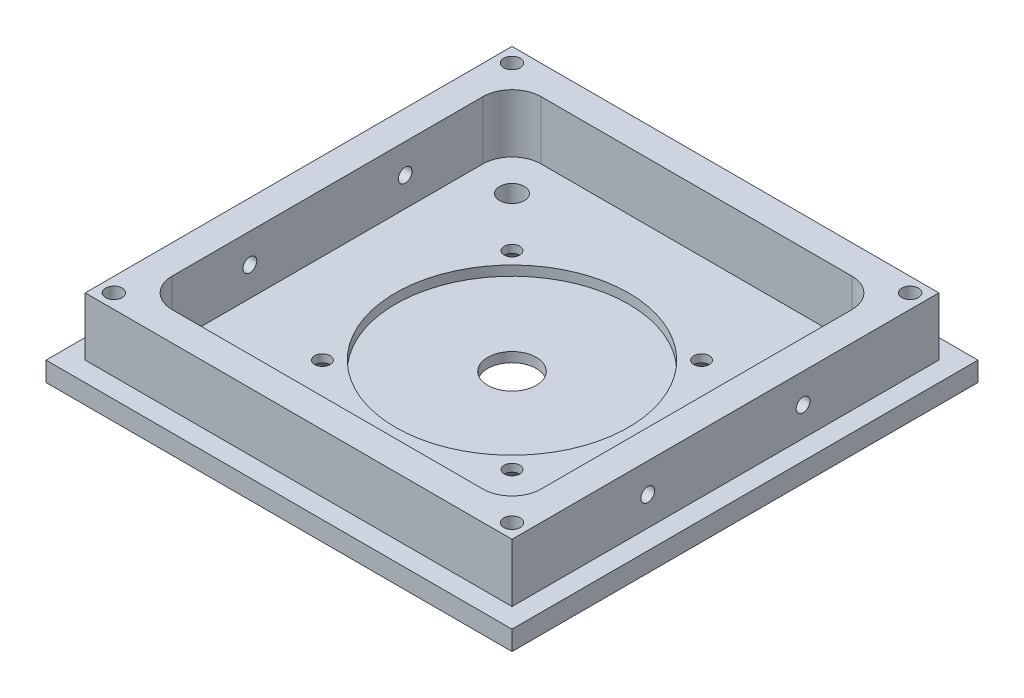
from build123d import *
from OCP.BRepFilletAPI import BRepFilletAPI_MakeChamfer

# Parameters (mm, degrees)
SKETCH1_W                    = 76.2
SKETCH1_H                    = 76.2
BOSS_EXTRUDE1_DEPTH          = 3.175
SKETCH2_W                    = 69.79412
SKETCH2_H                    = 69.79412
SKETCH2_W_2                  = 60.325
SKETCH2_H_2                  = 60.325
BOSS_EXTRUDE2_DEPTH          = 9.525
FILLET1_R                    = 4.7625
SKETCH3_R                    = 19.05
CUT_EXTRUDE1_DEPTH           = 1.5875
SKETCH4_R                    = 3.96875
CUT_EXTRUDE2_DEPTH           = 56.015521957
F_39_0_0995_DIAMETER_HOLE1_D = 2.5273
F_10_32_TAPPED_HOLE1_D       = 4.0386
CHAMFER1_SIZE                = 1.905
CHAMFER1_SIZE2               = 1.655991236
F_6_32_TAPPED_HOLE1_D        = 2.7051
CIRPATTERN1_COUNT            = 4


with BuildPart() as part:
    # Sketch1 → Boss-Extrude1 (new body)
    with BuildSketch(Plane(origin=(0, 0, 0), x_dir=(1, 0, 0), z_dir=(0, 1, 0))):
        Rectangle(SKETCH1_W, SKETCH1_H)
    extrude(amount=BOSS_EXTRUDE1_DEPTH)

    # Sketch2 → Boss-Extrude2 (add)
    with BuildSketch(Plane(origin=(0, 3.175, 0), x_dir=(1, 0, 0), z_dir=(0, 1, 0))):
        Rectangle(SKETCH2_W, SKETCH2_H)
        Rectangle(SKETCH2_W_2, SKETCH2_H_2, mode=Mode.SUBTRACT)
    extrude(amount=BOSS_EXTRUDE2_DEPTH)

    # Fillet1
    fillet1_edges = [part.edges().sort_by_distance(p)[0] for p in [
        (-30.1625, 7.9375, 30.1625),
        (30.1625, 7.9375, 30.1625),
        (30.1625, 7.9375, -30.1625),
        (-30.1625, 7.9375, -30.1625),
    ]]
    fillet(fillet1_edges, radius=FILLET1_R)

    # Sketch3 → Cut-Extrude1 (cut)
    with BuildSketch(Plane(origin=(0, 3.175, 0), x_dir=(1, 0, 0), z_dir=(0, 1, 0))):
        with Locations(Location((0, 0, 0), (0, 0, 270))):
            Circle(SKETCH3_R)
    extrude(amount=-CUT_EXTRUDE1_DEPTH, mode=Mode.SUBTRACT)

    # Sketch4 → Cut-Extrude2 (cut, through all)
    with BuildSketch(Plane(origin=(0, 1.5875, 0), x_dir=(1, 0, 0), z_dir=(0, 1, 0))):
        with Locations(Location((0, 0, 0), (0, 0, 270))):
            Circle(SKETCH4_R)
    extrude(amount=-CUT_EXTRUDE2_DEPTH, mode=Mode.SUBTRACT)

    # #39 (0.0995) Diameter Hole1 (through all)
    with Locations(Plane(origin=(0, 3.175, 0), x_dir=(1, 0, 0), z_dir=(0, 1, 0))):
        with Locations((15.5, 15.5), (-15.5, 15.5), (-15.5, -15.5), (15.5, -15.5), (-23.5966, 23.5966), (23.5966, 23.5966), (23.5966, -23.5966), (-23.5966, -23.5966)):
            Hole(F_39_0_0995_DIAMETER_HOLE1_D / 2)

    # #10-32 Tapped Hole1 (through all)
    with Locations(Plane(origin=(0, 3.175, 0), x_dir=(1, 0, 0), z_dir=(0, 1, 0))):
        with Locations((-23.5966, 23.5966), (23.5966, 23.5966), (23.5966, -23.5966), (-23.5966, -23.5966)):
            Hole(F_10_32_TAPPED_HOLE1_D / 2)

    # Sketch9 → #4-40 Tapped Hole1 (revolve, cut)
    with BuildSketch(Plane(origin=(34.89706, 7.9375, 12.7), x_dir=(0, 0, -1), z_dir=(0, 1, 0))):
        Polygon((0, 0), (0, 7.283152758), (1.1303, 6.604), (1.1303, 0), align=None)
    f_4_40_tapped_hole1 = revolve(axis=Axis((41.24706, 7.9375, 12.7), (-1, 0, 0)), mode=Mode.SUBTRACT)

    # Mirror1: #4-40 Tapped Hole1 across plane
    add(f_4_40_tapped_hole1.mirror(Plane.XY), mode=Mode.SUBTRACT)

    # Mirror2: #4-40 Tapped Hole1 across plane
    add(f_4_40_tapped_hole1.mirror(Plane(origin=(0, 0, 0), x_dir=(0, 0, 1), z_dir=(1, 0, 0))), mode=Mode.SUBTRACT)

    # Mirror2 copy 1 sketch → Mirror2 copy 1 (revolve, cut)
    with BuildSketch(Plane(origin=(-34.89706, 7.9375, -12.7), x_dir=(0, 0, 1), z_dir=(0, 1, 0))):
        Polygon((0, 0), (0, 7.283152758), (1.1303, 6.604), (1.1303, 0), align=None)
    revolve(axis=Axis((-41.24706, 7.9375, -12.7), (1, 0, 0)), mode=Mode.SUBTRACT)

    # Chamfer1: one chamfer whose edges measure the first distance from different faces: ONE call of the kernel's chamfer builder (chamfer() names one face for all edges)
    chamfer1_edges_1 = [part.edges().sort_by_distance(p)[0] for p in [
        (16.76365, 0, 15.5),
    ]]
    chamfer1_side_1 = [part.faces().sort_by_distance(p)[0] for p in [
        (16.76365, 1.5875, 15.5),
    ]]
    chamfer1_edges_2 = [part.edges().sort_by_distance(p)[0] for p in [
        (-14.23635, 0, 15.5),
    ]]
    chamfer1_side_2 = [part.faces().sort_by_distance(p)[0] for p in [
        (-14.23635, 1.5875, 15.5),
    ]]
    chamfer1_edges_3 = [part.edges().sort_by_distance(p)[0] for p in [
        (-14.23635, 0, -15.5),
    ]]
    chamfer1_side_3 = [part.faces().sort_by_distance(p)[0] for p in [
        (-14.23635, 1.5875, -15.5),
    ]]
    chamfer1_edges_4 = [part.edges().sort_by_distance(p)[0] for p in [
        (16.76365, 0, -15.5),
    ]]
    chamfer1_side_4 = [part.faces().sort_by_distance(p)[0] for p in [
        (16.76365, 1.5875, -15.5),
    ]]
    chamfer1 = BRepFilletAPI_MakeChamfer(part.part.solid().wrapped)
    for e in chamfer1_edges_1:
        chamfer1.Add(CHAMFER1_SIZE, CHAMFER1_SIZE2, e.wrapped, chamfer1_side_1[0].wrapped)  # the first distance lies on this face
    for e in chamfer1_edges_2:
        chamfer1.Add(CHAMFER1_SIZE, CHAMFER1_SIZE2, e.wrapped, chamfer1_side_2[0].wrapped)  # the first distance lies on this face
    for e in chamfer1_edges_3:
        chamfer1.Add(CHAMFER1_SIZE, CHAMFER1_SIZE2, e.wrapped, chamfer1_side_3[0].wrapped)  # the first distance lies on this face
    for e in chamfer1_edges_4:
        chamfer1.Add(CHAMFER1_SIZE, CHAMFER1_SIZE2, e.wrapped, chamfer1_side_4[0].wrapped)  # the first distance lies on this face
    add(Compound.cast(chamfer1.Shape()), mode=Mode.REPLACE)

    # #6-32 Tapped Hole1 (through all)
    with Locations(Plane(origin=(0, 0, 0), x_dir=(-1, 0, 0), z_dir=(0, -1, 0))):
        with Locations((-32.5501, 32.5501)):
            f_6_32_tapped_hole1 = Hole(F_6_32_TAPPED_HOLE1_D / 2)

    # CirPattern1: #6-32 Tapped Hole1 ×4 about axis
    cirpattern1_axis = Axis((0, 0, 0), (0, 1, 0))
    for i in range(1, CIRPATTERN1_COUNT):
        add(f_6_32_tapped_hole1.rotate(cirpattern1_axis, i * 360 / CIRPATTERN1_COUNT), mode=Mode.SUBTRACT)


solid = part.part
